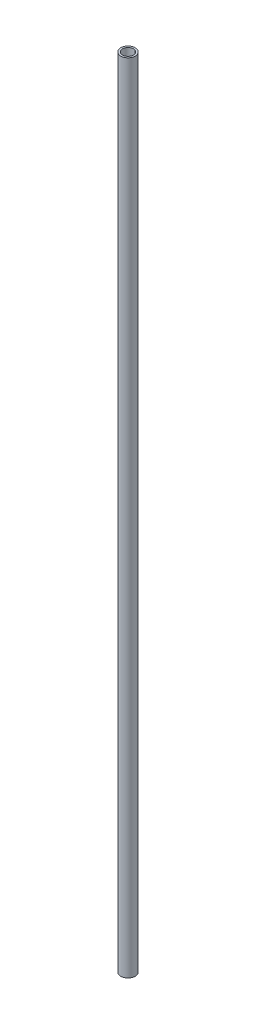
from build123d import *

# Parameters (mm, degrees)
SKETCH1_R           = 5
SKETCH1_R_2         = 3.75
BOSS_EXTRUDE1_DEPTH = 275


with BuildPart() as part:
    # Sketch1 → Boss-Extrude1 (new, symmetric)
    with BuildSketch(Plane(origin=(0, 0, 0), x_dir=(1, 0, 0), z_dir=(0, 1, 0))):
        with Locations(Location((0, 0, 0), (0, 0, 270))):
            Circle(SKETCH1_R)
        with Locations(Location((0, 0, 0), (0, 0, 270))):
            Circle(SKETCH1_R_2, mode=Mode.SUBTRACT)
    extrude(amount=BOSS_EXTRUDE1_DEPTH, both=True)


solid = part.part
